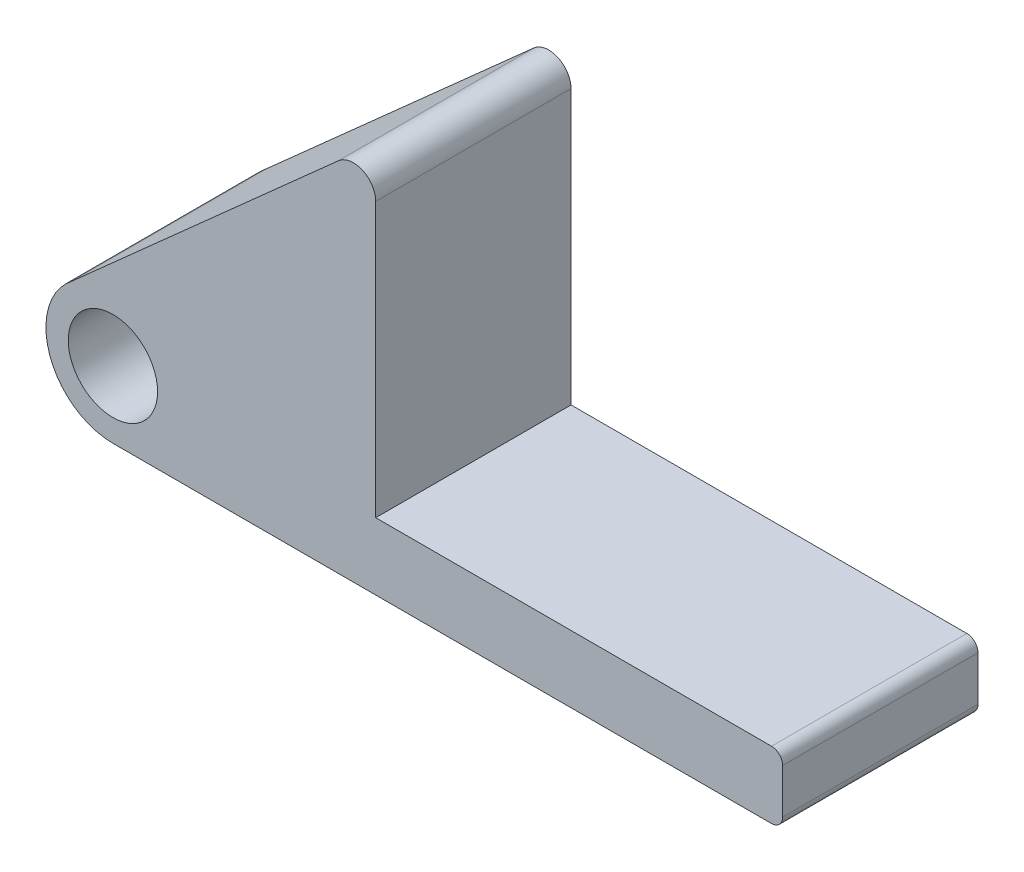
from build123d import *

# Parameters (mm, degrees)
ESQUISSE1_R        = 6
ESQUISSE1_R_2      = 4
BOSS_EXTRU_1_DEPTH = 17.5
CONG_2_R           = 2
CONG_3_R           = 1
CONG_4_R           = 1


with BuildPart() as part:
    # Esquisse1 → Boss.-Extru.1 (new body)
    # profile 1 of 2: a face of its own
    with BuildSketch(Plane.XY):
        Circle(ESQUISSE1_R)
        Circle(ESQUISSE1_R_2, mode=Mode.SUBTRACT)
    # profile 2 of 2: a face of its own
    with BuildSketch(Plane.XY):
        with BuildLine():
            Line((23.543392678, 29), (-3.675906783, 4.742120762))
            ThreePointArc((-3.675906783, 4.742120762), (2.640507461, 5.387737962), (6, 0))
            ThreePointArc((6, 0), (4.242640687, -4.242640687), (0, -6))
            Line((0, -6), (60, -6))
            Line((60, -6), (60, 0))
            Line((60, 0), (23.543392678, 0))
            Line((23.543392678, 0), (23.543392678, 29))
        make_face()
    extrude(amount=-BOSS_EXTRU_1_DEPTH)

    # Congé2
    cong_2_edges = [part.edges().sort_by_distance(p)[0] for p in [
        (23.543392678, 29, -8.75),
    ]]
    fillet(cong_2_edges, radius=CONG_2_R)

    # Congé3
    cong_3_edges = [part.edges().sort_by_distance(p)[0] for p in [
        (60, 0, -8.75),
    ]]
    fillet(cong_3_edges, radius=CONG_3_R)

    # Congé4
    cong_4_edges = [part.edges().sort_by_distance(p)[0] for p in [
        (60, -6, -8.75),
    ]]
    fillet(cong_4_edges, radius=CONG_4_R)


solid = part.part
